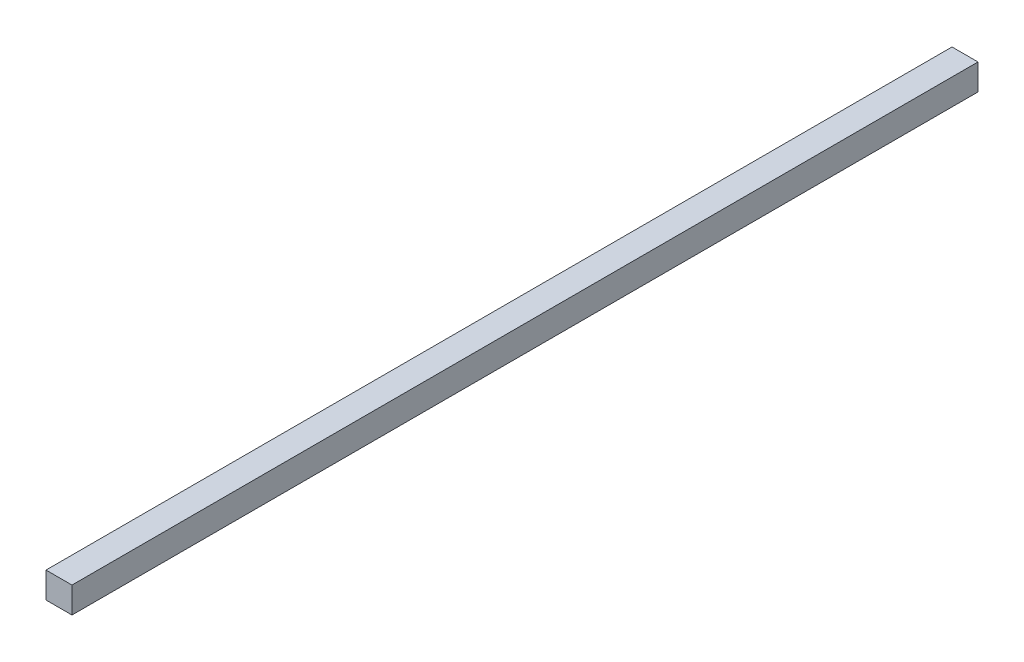
from build123d import *

# Parameters (mm, degrees)
SKETCH1_W           = 2.86759605
SKETCH1_H           = 2.86759605
BOSS_EXTRUDE1_DEPTH = 100


with BuildPart() as part:
    # Sketch1 → Boss-Extrude1 (new body)
    with BuildSketch(Plane.XY):
        Rectangle(SKETCH1_W, SKETCH1_H)
    extrude(amount=BOSS_EXTRUDE1_DEPTH)


solid = part.part
